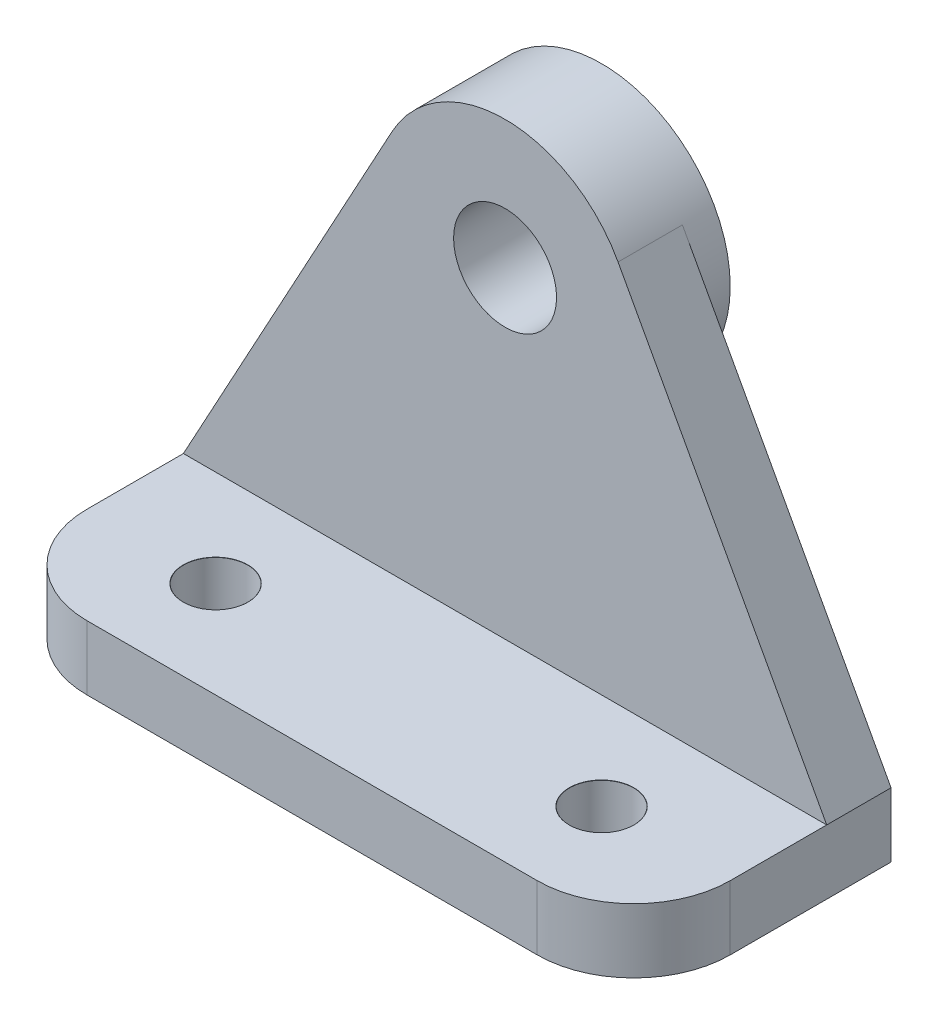
from build123d import *

# Parameters (mm, degrees)
CROQUIS1_W                           = 100
CROQUIS1_H                           = 40
SALIENTE_EXTRUIR1_DEPTH              = 10
CROQUIS2_R                           = 8
SALIENTE_EXTRUIR2_DEPTH              = 10
SALIENTE_EXTRUIR3_START              = -15
CROQUIS3_R                           = 20
CROQUIS3_R_2                         = 8
SALIENTE_EXTRUIR3_DEPTH              = 15
F_10_0_10_DIAMETER_HOLE1_D           = 10
F_10_0_10_DIAMETER_HOLE1_CSINK_D     = 10.05
F_10_0_10_DIAMETER_HOLE1_CSINK_ANGLE = 100
F_10_0_10_DIAMETER_HOLE2_D           = 10
F_10_0_10_DIAMETER_HOLE2_CSINK_D     = 10.05
F_10_0_10_DIAMETER_HOLE2_CSINK_ANGLE = 100
REDONDEO2_R                          = 15


with BuildPart() as part:
    # Croquis1 → Saliente-Extruir1 (new body)
    with BuildSketch(Plane(origin=(0, 0, 0), x_dir=(1, 0, 0), z_dir=(0, 1, 0))):
        with Locations((0, 20)):
            Rectangle(CROQUIS1_W, CROQUIS1_H)
    extrude(amount=SALIENTE_EXTRUIR1_DEPTH)

    # Croquis2 → Saliente-Extruir2 (add)
    with BuildSketch(Plane(origin=(0, 0, -40), x_dir=(-1, 0, 0), z_dir=(0, 0, -1))):
        with BuildLine():
            Line((-17.564659966, 69.564659966), (-50, 10))
            Line((-50, 10), (50, 10))
            Line((50, 10), (17.564659966, 69.564659966))
            ThreePointArc((17.564659966, 69.564659966), (0, 80), (-17.564659966, 69.564659966))
        make_face()
        with Locations((0, 60)):
            Circle(CROQUIS2_R, mode=Mode.SUBTRACT)
    extrude(amount=-SALIENTE_EXTRUIR2_DEPTH)

    # Croquis3 → Saliente-Extruir3 (add)
    with BuildSketch(Plane.XY.offset(-30).offset(SALIENTE_EXTRUIR3_START)):
        with Locations(Location((0, 60, 0), (0, 0, 151.429940189))):
            Circle(CROQUIS3_R)
        with Locations(Location((0, 60, 0), (0, 0, 180))):
            Circle(CROQUIS3_R_2, mode=Mode.SUBTRACT)
    extrude(amount=SALIENTE_EXTRUIR3_DEPTH)

    # Ø10.0 (10) Diameter Hole1 (through all)
    with Locations(Plane(origin=(0, 10, 0), x_dir=(1, 0, 0), z_dir=(0, 1, 0))):
        with Locations((30, 15)):
            CounterSinkHole(F_10_0_10_DIAMETER_HOLE1_D / 2, F_10_0_10_DIAMETER_HOLE1_CSINK_D / 2, counter_sink_angle=F_10_0_10_DIAMETER_HOLE1_CSINK_ANGLE)

    # Ø10.0 (10) Diameter Hole2 (through all)
    with Locations(Plane(origin=(0, 10, 0), x_dir=(1, 0, 0), z_dir=(0, 1, 0))):
        with Locations((-30, 15)):
            CounterSinkHole(F_10_0_10_DIAMETER_HOLE2_D / 2, F_10_0_10_DIAMETER_HOLE2_CSINK_D / 2, counter_sink_angle=F_10_0_10_DIAMETER_HOLE2_CSINK_ANGLE)

    # Redondeo2
    redondeo2_edges = [part.edges().sort_by_distance(p)[0] for p in [
        (50, 5, 0),
        (-50, 5, 0),
    ]]
    fillet(redondeo2_edges, radius=REDONDEO2_R)


solid = part.part
